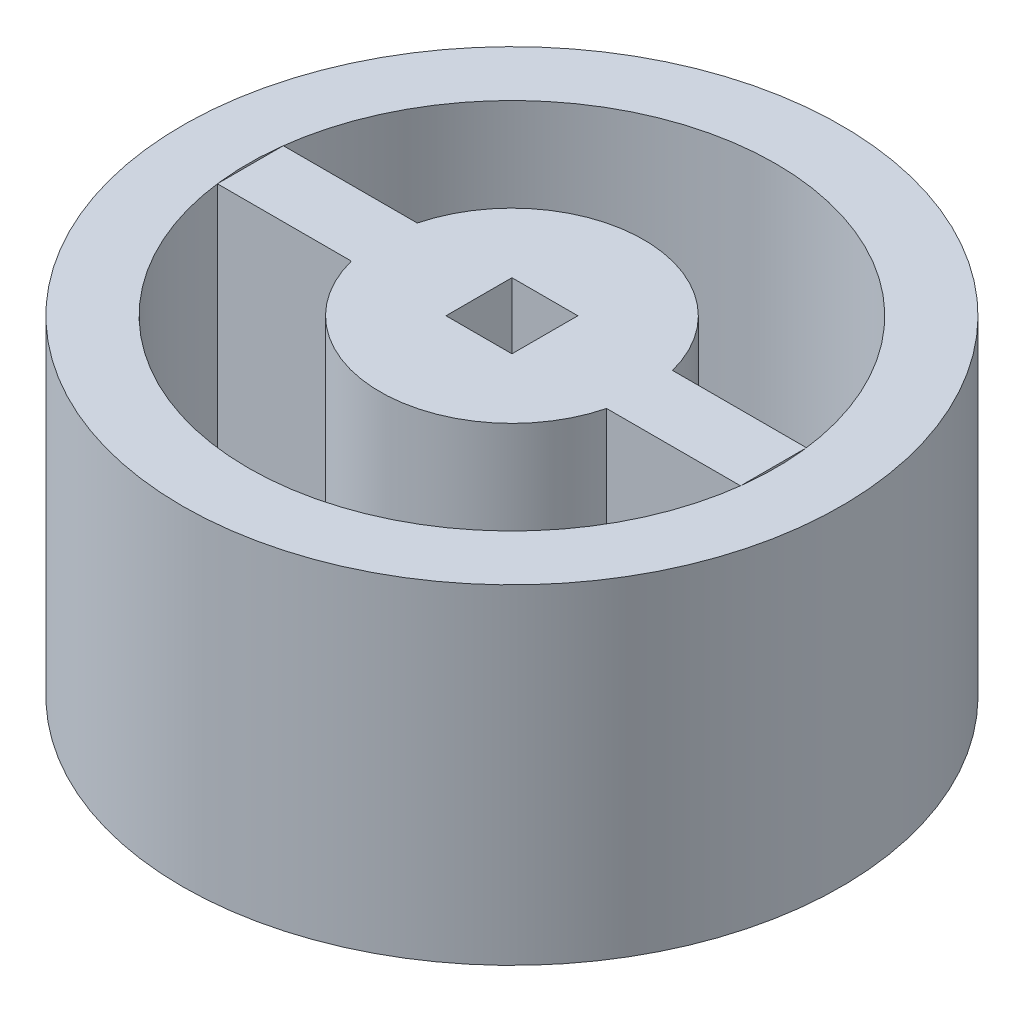
from build123d import *

# Parameters (mm, degrees)
SKETCH2_R               = 5
SKETCH2_W               = 1
SKETCH2_H               = 1
BOSS_EXTRUDE1_DEPTH     = 5
CUT_EXTRUDE1_DEPTH      = 9.660254038
CUT_EXTRUDE1_DEPTH_BACK = 9.660254038
SKETCH4_R               = 4
SKETCH4_R_2             = 2
SKETCH6_W               = 7.937253934
SKETCH6_H               = 1
BOSS_EXTRUDE2_DEPTH     = 5
CUT_EXTRUDE2_DEPTH      = 9.660254038
CUT_EXTRUDE2_DEPTH_BACK = 9.660254038
SKETCH7_W               = 1
SKETCH7_H               = 1


with BuildPart() as part:
    # Sketch2 → Boss-Extrude1 (new body)
    with BuildSketch(Plane(origin=(0, 0, 0), x_dir=(1, 0, 0), z_dir=(0, 1, 0))):
        with Locations(Location((0, 0, 0), (0, 0, 270))):
            Circle(SKETCH2_R)
        Rectangle(SKETCH2_W, SKETCH2_H, mode=Mode.SUBTRACT)
    extrude(amount=BOSS_EXTRUDE1_DEPTH)

    # Sketch4 → Cut-Extrude1 (cut, two sides: drawn at the far end of the back side and taken through both)
    with BuildSketch(Plane.XZ.offset(-CUT_EXTRUDE1_DEPTH_BACK)):
        with Locations(Location((0, 0, 0), (0, 0, 270))):
            Circle(SKETCH4_R)
        with Locations(Location((0, 0, 0), (0, 0, 270))):
            Circle(SKETCH4_R_2, mode=Mode.SUBTRACT)
    extrude(amount=CUT_EXTRUDE1_DEPTH + CUT_EXTRUDE1_DEPTH_BACK, mode=Mode.SUBTRACT)


with BuildPart() as cut_extrude1_piece_1:
    # of the separate pieces the step leaves, piece 1, a body of its own (cut_extrude1_pieces)
    add(part.part.solids().sort_by_distance((0, 0, 5))[0])


with BuildPart() as cut_extrude1_piece_2:
    # of the separate pieces the step leaves, piece 2, a body of its own (cut_extrude1_pieces)
    add(part.part.solids().sort_by_distance((0, 0, -2))[0])

    # Sketch6 → Boss-Extrude2 (add)
    with BuildSketch(Plane(origin=(0, 5, 0), x_dir=(1, 0, 0), z_dir=(0, 1, 0))):
        Rectangle(SKETCH6_W, SKETCH6_H)
    extrude(amount=-BOSS_EXTRUDE2_DEPTH)

    # Sketch7 → Cut-Extrude2 (cut, two sides: drawn at the far end of the back side and taken through both)
    with BuildSketch(Plane(origin=(0, 5, 0), x_dir=(1, 0, 0), z_dir=(0, 1, 0)).offset(-CUT_EXTRUDE2_DEPTH_BACK)):
        Rectangle(SKETCH7_W, SKETCH7_H)
    extrude(amount=CUT_EXTRUDE2_DEPTH + CUT_EXTRUDE2_DEPTH_BACK, mode=Mode.SUBTRACT)


solid = Compound([cut_extrude1_piece_1.part, cut_extrude1_piece_2.part])
